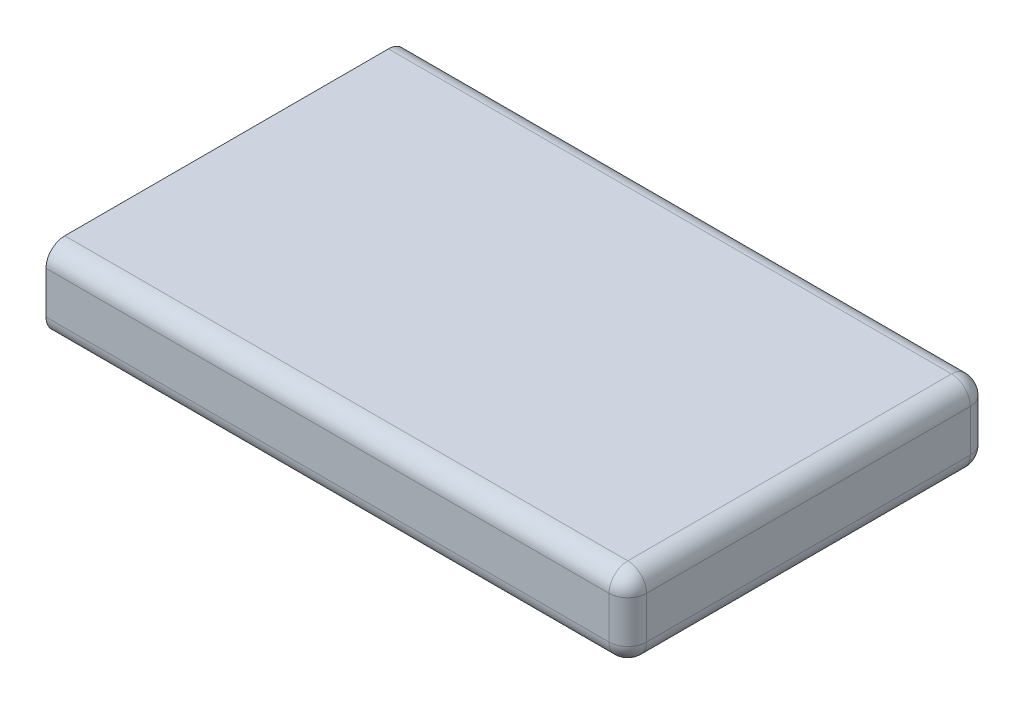
from build123d import *

# Parameters (mm, degrees)
SKETCH1_W           = 62
SKETCH1_H           = 38.5
BOSS_EXTRUDE1_DEPTH = 8.5
FILLET1_R           = 2


with BuildPart() as part:
    # Sketch1 → Boss-Extrude1 (new body)
    with BuildSketch(Plane(origin=(0, 0, 0), x_dir=(1, 0, 0), z_dir=(0, 1, 0))):
        with Locations((31, -19.25)):
            Rectangle(SKETCH1_W, SKETCH1_H)
    extrude(amount=BOSS_EXTRUDE1_DEPTH)

    # Fillet1
    fillet1_edges = [part.edges().sort_by_distance(p)[0] for p in [
        (62, 8.5, 19.25),
        (31, 8.5, 0),
        (31, 0, 0),
        (62, 0, 19.25),
        (31, 0, 38.5),
        (62, 4.25, 0),
        (62, 4.25, 38.5),
        (31, 8.5, 38.5),
    ]]
    fillet(fillet1_edges, radius=FILLET1_R)


solid = part.part
